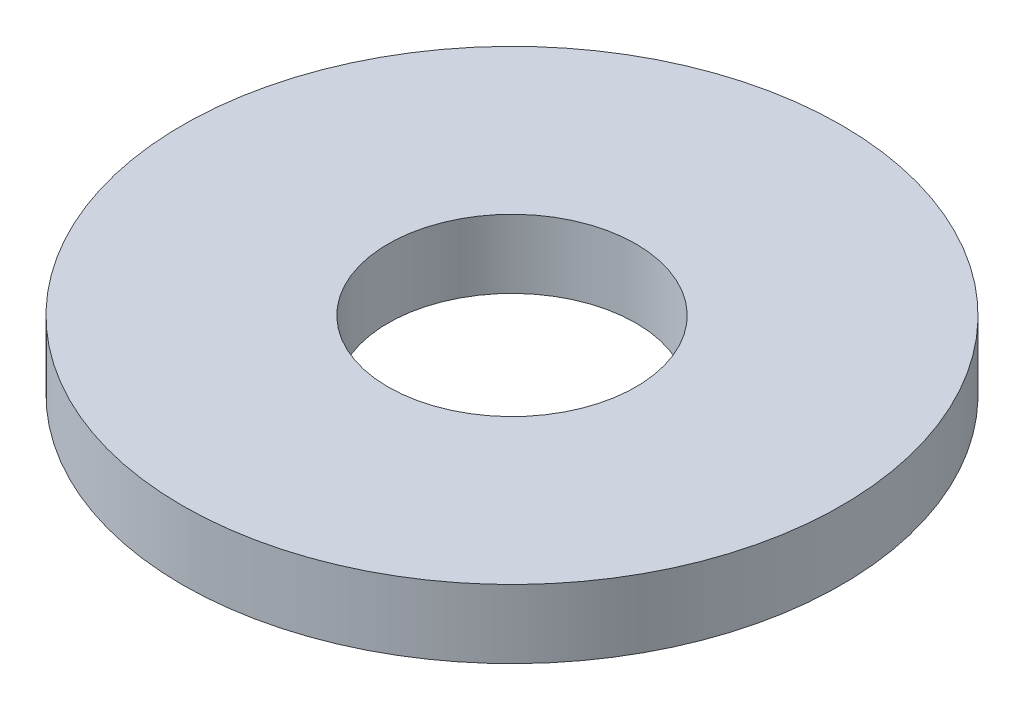
from build123d import *

# Parameters (mm, degrees)
SKETCH1_R           = 4.7625
BOSS_EXTRUDE1_DEPTH = 0.9906
SKETCH5_R           = 1.7907
CUT_EXTRUDE1_DEPTH  = 7.807650172


with BuildPart() as part:
    # Sketch1 → Boss-Extrude1 (new body)
    with BuildSketch(Plane(origin=(0, 0, 0), x_dir=(1, 0, 0), z_dir=(0, 1, 0))):
        with Locations(Location((0, 0, 0), (0, 0, 270))):
            Circle(SKETCH1_R)
    extrude(amount=BOSS_EXTRUDE1_DEPTH)

    # Sketch5 → Cut-Extrude1 (cut, through all)
    with BuildSketch(Plane(origin=(0, 0.9906, 0), x_dir=(-1, 0, 0), z_dir=(0, 1, 0))):
        with Locations(Location((0, 0, 0), (0, 0, 90))):
            Circle(SKETCH5_R)
    extrude(amount=-CUT_EXTRUDE1_DEPTH, mode=Mode.SUBTRACT)


solid = part.part
